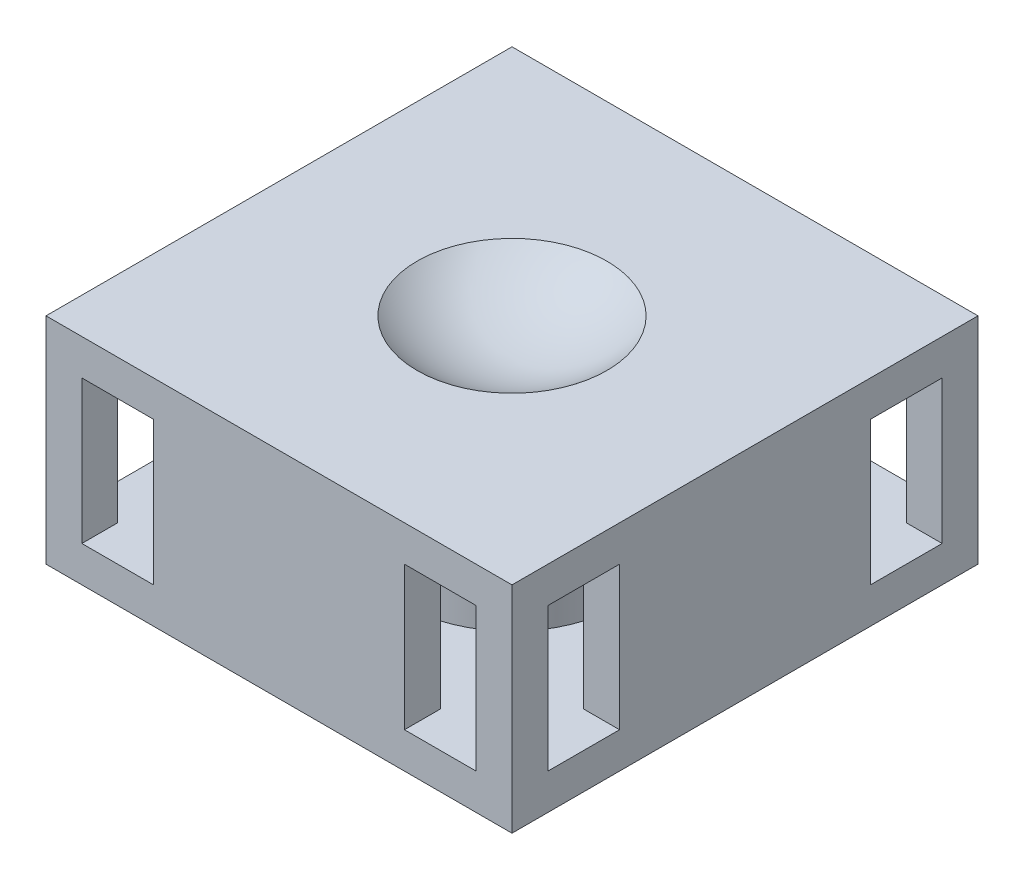
from build123d import *

# Parameters (mm, degrees)
SKETCH4_W           = 65
SKETCH4_H           = 65
BOSS_EXTRUDE2_DEPTH = 45
SKETCH6_W           = 65
SKETCH6_H           = 65
CUT_EXTRUDE2_DEPTH  = 15
SKETCH7_W           = 10
SKETCH7_H           = 20
CUT_EXTRUDE3_DEPTH  = 92.416994223
SKETCH8_W           = 10
SKETCH8_H           = 20
CUT_EXTRUDE4_DEPTH  = 111.666551289
FILLET1_R           = 15


with BuildPart() as part:
    # Sketch4 → Boss-Extrude2 (new body)
    with BuildSketch(Plane(origin=(0, 0, 0), x_dir=(1, 0, 0), z_dir=(0, 1, 0))):
        with Locations((44.940852102, -13.402797658)):
            Rectangle(SKETCH4_W, SKETCH4_H)
    extrude(amount=-BOSS_EXTRUDE2_DEPTH)

    # Sketch5 → Cut-Revolve2 (revolve, cut)
    with BuildSketch(Plane(origin=(0, 0, 0), x_dir=(1, 0, 0), z_dir=(0, 1, 0))):
        with BuildLine():
            Line((24.940852102, -13.402797658), (64.940852102, -13.402797658))
            ThreePointArc((64.940852102, -13.402797658), (44.940852102, 6.597202342), (24.940852102, -13.402797658))
        make_face()
    revolve(axis=Axis((24.940852102, 0, 13.402797658), (1, 0, 0)), mode=Mode.SUBTRACT)

    # Sketch6 → Cut-Extrude2 (cut)
    with BuildSketch(Plane(origin=(0, 0, 0), x_dir=(1, 0, 0), z_dir=(0, 1, 0))):
        with Locations((44.940852102, -13.402797658)):
            Rectangle(SKETCH6_W, SKETCH6_H)
    extrude(amount=-CUT_EXTRUDE2_DEPTH, mode=Mode.SUBTRACT)

    # Sketch7 → Cut-Extrude3 (cut, through all)
    with BuildSketch(Plane.ZY.offset(-12.440852102)):
        with Locations((-9.097202342, -30)):
            Rectangle(SKETCH7_W, SKETCH7_H)
        with Locations((35.902797658, -30)):
            Rectangle(SKETCH7_W, SKETCH7_H)
    extrude(amount=-CUT_EXTRUDE3_DEPTH, mode=Mode.SUBTRACT)

    # Sketch8 → Cut-Extrude4 (cut, through all)
    with BuildSketch(Plane(origin=(0, 0, -19.097202342), x_dir=(-1, 0, 0), z_dir=(0, 0, -1))):
        with Locations((-67.440852102, -30)):
            Rectangle(SKETCH8_W, SKETCH8_H)
        with Locations((-22.440852102, -30)):
            Rectangle(SKETCH8_W, SKETCH8_H)
    extrude(amount=-CUT_EXTRUDE4_DEPTH, mode=Mode.SUBTRACT)

    # Fillet1
    fillet1_edges = [part.edges().sort_by_distance(p)[0] for p in [
        (27.440852102, -30, 30.902797658),
        (27.440852102, -30, -4.097202342),
        (62.440852102, -30, 30.902797658),
        (62.440852102, -30, -4.097202342),
    ]]
    fillet(fillet1_edges, radius=FILLET1_R)


solid = part.part
